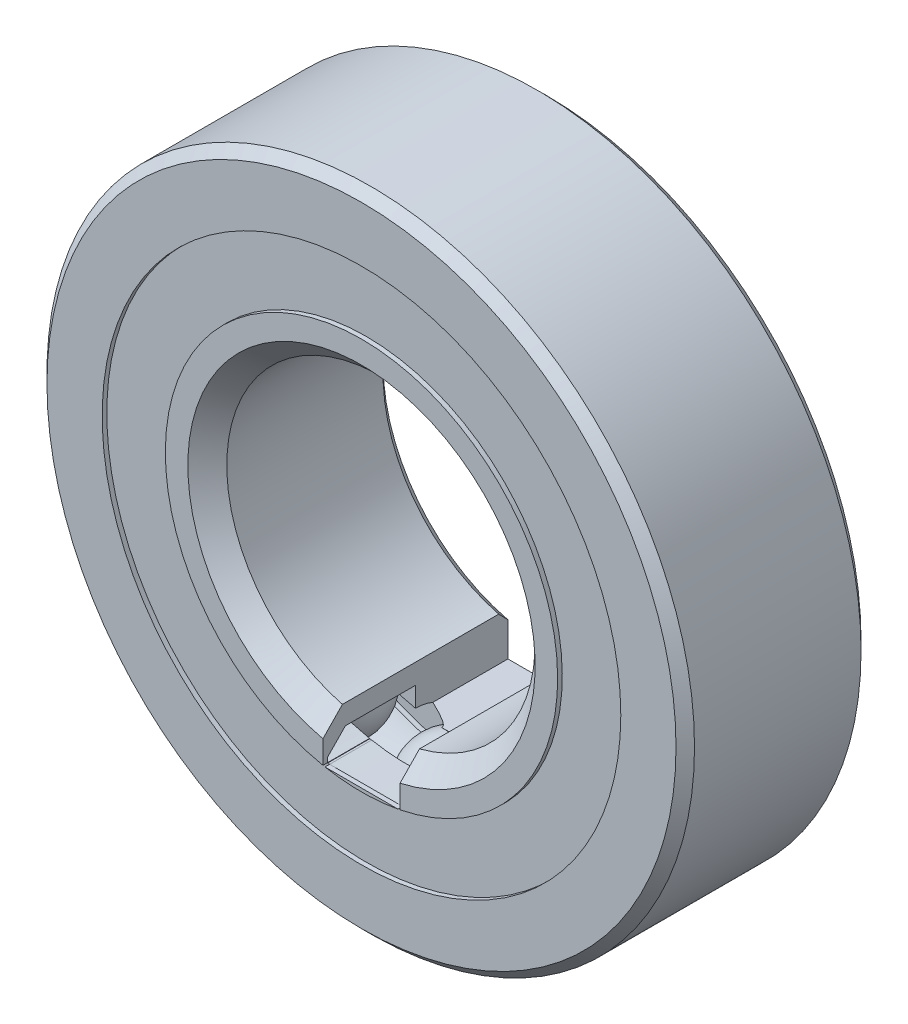
from build123d import *

# Parameters (mm, degrees)
CIRPATTERN1_COUNT  = 12
SKETCH5_W          = 2.725099744
SKETCH5_H          = 4.096747042
SKETCH6_W          = 5
SKETCH6_H          = 5
CUT_EXTRUDE1_DEPTH = 33.031234756


with BuildPart() as part:
    # Sketch1 → Revolve1 (revolve)
    with BuildSketch(Plane(origin=(0, 0, 0), x_dir=(0, 0, -1), z_dir=(1, 0, 0))):
        with BuildLine():
            Line((5.4, 21), (-5.4, 21))
            Line((-5.4, 21), (-6, 20.4))
            Line((-6, 20.4), (-6, 16.818681319))
            Line((-6, 16.818681319), (-2.666666667, 16.818681319))
            ThreePointArc((-2.666666667, 16.818681319), (0, 18.474900256), (2.666666667, 16.818681319))
            Line((2.666666667, 16.818681319), (6, 16.818681319))
            Line((6, 16.818681319), (6, 20.4))
            Line((6, 20.4), (5.4, 21))
        make_face()
    revolve(axis=Axis((0, 0, 6), (0, 0, -1)))


with BuildPart() as body_2:
    # Sketch3 → Revolve3 (revolve)
    with BuildSketch(Plane(origin=(0, 0, 0), x_dir=(0, 0, -1), z_dir=(1, 0, 0))):
        with BuildLine():
            Line((-5.7, 12.421934277), (-4.540615595, 11.262549872))
            Line((-4.540615595, 11.262549872), (0, 11.262549872))
            Line((0, 11.262549872), (0, 12.525099744))
            ThreePointArc((0, 12.525099744), (1.569567797, 12.972849735), (2.666666667, 14.181318681))
            Line((2.666666667, 14.181318681), (6, 14.181318681))
            Line((6, 14.181318681), (6, 10.6))
            Line((6, 10.6), (5.4, 10))
            Line((5.4, 10), (-4.737450128, 10))
            Line((-4.737450128, 10), (-6, 11.262549872))
            Line((-6, 11.262549872), (-6, 12.721934277))
            Line((-6, 12.721934277), (-5.7, 12.721934277))
            Line((-5.7, 12.721934277), (-5.7, 12.421934277))
        make_face()
    revolve(axis=Axis((0, 0, 6), (0, 0, -1)))


with BuildPart() as body_3:
    # Sketch4 → Revolve4 (revolve)
    with BuildSketch(Plane(origin=(0, 0, 0), x_dir=(0, 0, -1), z_dir=(1, 0, 0))):
        with BuildLine():
            Line((-2.974900256, 15.5), (2.974900256, 15.5))
            ThreePointArc((2.974900256, 15.5), (0, 18.474900256), (-2.974900256, 15.5))
        make_face()
    revolve(axis=Axis((0, 15.5, 2.974900256), (0, 0, -1)))


with BuildPart() as cirpattern1_1:
    # CirPattern1: pattern copy
    add(body_3.part.rotate(Axis((0, 0, -6), (0, 0, 1)), 1 * 360 / CIRPATTERN1_COUNT))


with BuildPart() as cirpattern1_2:
    # CirPattern1: pattern copy
    add(body_3.part.rotate(Axis((0, 0, -6), (0, 0, 1)), 2 * 360 / CIRPATTERN1_COUNT))


with BuildPart() as cirpattern1_3:
    # CirPattern1: pattern copy
    add(body_3.part.rotate(Axis((0, 0, -6), (0, 0, 1)), 3 * 360 / CIRPATTERN1_COUNT))


with BuildPart() as cirpattern1_4:
    # CirPattern1: pattern copy
    add(body_3.part.rotate(Axis((0, 0, -6), (0, 0, 1)), 4 * 360 / CIRPATTERN1_COUNT))


with BuildPart() as cirpattern1_5:
    # CirPattern1: pattern copy
    add(body_3.part.rotate(Axis((0, 0, -6), (0, 0, 1)), 5 * 360 / CIRPATTERN1_COUNT))


with BuildPart() as cirpattern1_6:
    # CirPattern1: pattern copy
    add(body_3.part.rotate(Axis((0, 0, -6), (0, 0, 1)), 6 * 360 / CIRPATTERN1_COUNT))


with BuildPart() as cirpattern1_7:
    # CirPattern1: pattern copy
    add(body_3.part.rotate(Axis((0, 0, -6), (0, 0, 1)), 7 * 360 / CIRPATTERN1_COUNT))


with BuildPart() as cirpattern1_8:
    # CirPattern1: pattern copy
    add(body_3.part.rotate(Axis((0, 0, -6), (0, 0, 1)), 8 * 360 / CIRPATTERN1_COUNT))


with BuildPart() as cirpattern1_9:
    # CirPattern1: pattern copy
    add(body_3.part.rotate(Axis((0, 0, -6), (0, 0, 1)), 9 * 360 / CIRPATTERN1_COUNT))


with BuildPart() as cirpattern1_10:
    # CirPattern1: pattern copy
    add(body_3.part.rotate(Axis((0, 0, -6), (0, 0, 1)), 10 * 360 / CIRPATTERN1_COUNT))


with BuildPart() as cirpattern1_11:
    # CirPattern1: pattern copy
    add(body_3.part.rotate(Axis((0, 0, -6), (0, 0, 1)), 11 * 360 / CIRPATTERN1_COUNT))


with BuildPart() as body_15:
    # Sketch5 → Revolve5 (revolve)
    with BuildSketch(Plane(origin=(0, 0, 0), x_dir=(0, 0, -1), z_dir=(1, 0, 0))):
        with Locations((-4.337450128, 14.770307798)):
            Rectangle(SKETCH5_W, SKETCH5_H)
        with Locations((4.337450128, 14.770307798)):
            Rectangle(SKETCH5_W, SKETCH5_H)
    revolve(axis=Axis((0, 0, 6), (0, 0, -1)))


with BuildPart() as cut_extrude1_tool:
    # Sketch6 → Cut-Extrude1 (new, through all)
    with BuildSketch(Plane.XY.offset(6)):
        with Locations((0, -10)):
            Rectangle(SKETCH6_W, SKETCH6_H)
    extrude(amount=-CUT_EXTRUDE1_DEPTH)


with BuildPart() as body_2_1:
    add(body_2.part)

    # Cut-Extrude1: cut by cut_extrude1_tool
    add(cut_extrude1_tool.part, mode=Mode.SUBTRACT)


with BuildPart() as body_15_1:
    add(body_15.part)

    # Cut-Extrude1: cut by cut_extrude1_tool
    add(cut_extrude1_tool.part, mode=Mode.SUBTRACT)


solid = Compound([part.part, body_3.part, cirpattern1_1.part, cirpattern1_2.part, cirpattern1_3.part, cirpattern1_4.part, cirpattern1_5.part, cirpattern1_6.part, cirpattern1_7.part, cirpattern1_8.part, cirpattern1_9.part, cirpattern1_10.part, cirpattern1_11.part, body_2_1.part, body_15_1.part])
